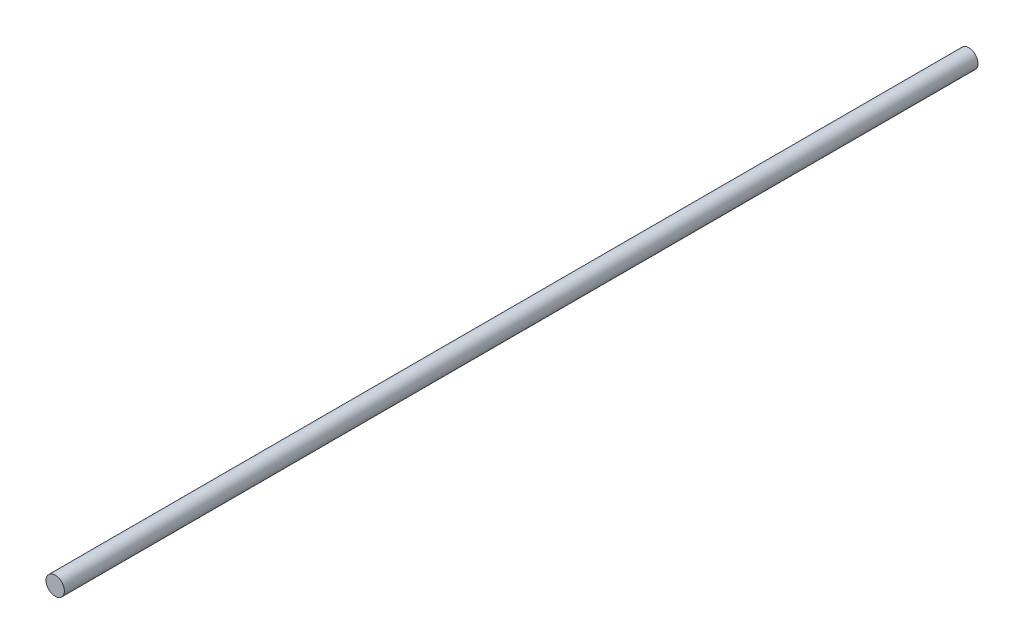
from build123d import *

# Parameters (mm, degrees)
SKETCH2_W = 397.80319436
SKETCH2_H = 4


with BuildPart() as part:
    # Sketch2 → Revolve1 (revolve)
    with BuildSketch(Plane(origin=(0, 0, 0), x_dir=(0, 0, -1), z_dir=(1, 0, 0)), mode=Mode.PRIVATE) as revolve1_sk:
        with Locations((191.101596989, 2)):
            Rectangle(SKETCH2_W, SKETCH2_H)
    revolve(revolve1_sk.sketch.rotate(Axis((0, 0, 7.800000191), (0, 0, -1)), 180), axis=Axis((0, 0, 7.800000191), (0, 0, -1)))


solid = part.part
